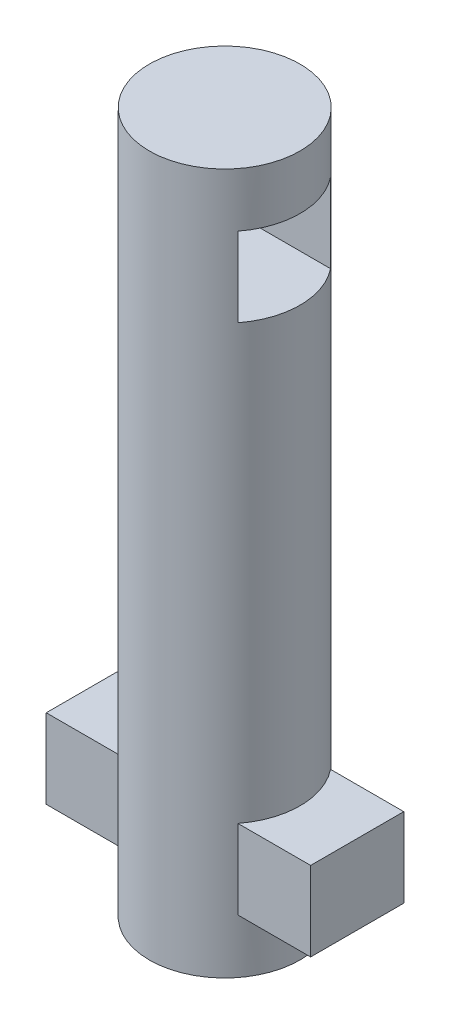
from build123d import *

# Parameters (mm, degrees)
SKETCH_1_R               = 5.7
EXTRUDE_1_DEPTH          = 53
CUT_EXTRUDE_1_DEPTH      = 54.609514081
CUT_EXTRUDE_1_DEPTH_BACK = 54.609514081
SKETCH_2_W               = 7.04551248
SKETCH_2_H               = 6
EXTRUDE_2_DEPTH          = 10
EXTRUDE_2_DEPTH_BACK     = 10
SKETCH_2_4_W             = 7.04551248
SKETCH_2_4_H             = 6


with BuildPart() as part:
    # 草图1 → 凸台-拉伸1 (new body)
    with BuildSketch(Plane(origin=(0, 0, 0), x_dir=(1, 0, 0), z_dir=(0, 1, 0))):
        Circle(SKETCH_1_R)
    extrude(amount=EXTRUDE_1_DEPTH)

    # 草图2 → 切除-拉伸1 (cut, two sides: drawn at the far end of the back side and taken through both)
    with BuildSketch(Plane(origin=(0, 0, 0), x_dir=(0, 0, -1), z_dir=(1, 0, 0)).offset(-CUT_EXTRUDE_1_DEPTH_BACK)):
        with Locations((0.02275624, 45.9)):
            Rectangle(SKETCH_2_W, SKETCH_2_H)
    extrude(amount=CUT_EXTRUDE_1_DEPTH + CUT_EXTRUDE_1_DEPTH_BACK, mode=Mode.SUBTRACT)

    # 草图2<4> → 凸台-拉伸2 (add, two sides: drawn at the far end of the back side and taken through both)
    with BuildSketch(Plane(origin=(0, 0, 0), x_dir=(0, 0, -1), z_dir=(1, 0, 0)).offset(-EXTRUDE_2_DEPTH_BACK)):
        with Locations((0.02275624, 7.1)):
            Rectangle(SKETCH_2_4_W, SKETCH_2_4_H)
    extrude(amount=EXTRUDE_2_DEPTH + EXTRUDE_2_DEPTH_BACK)


solid = part.part
